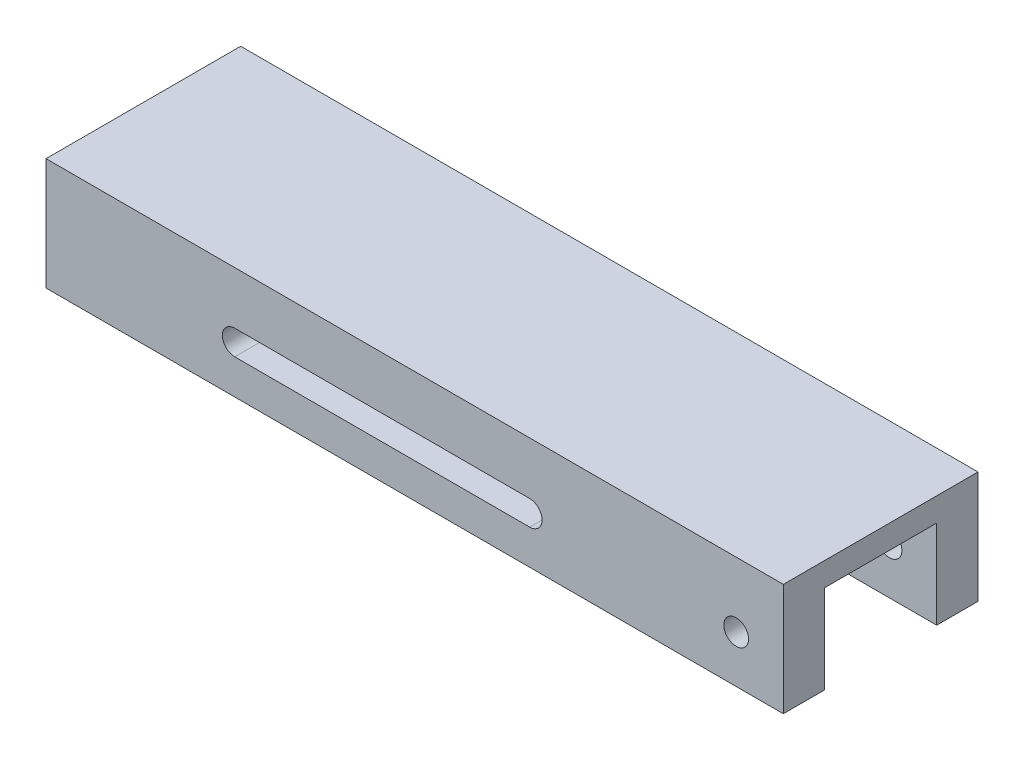
from build123d import *

# Parameters (mm, degrees)
BOSS_EXTRUDE1_DEPTH            = 15
SKETCH3_R                      = 2.1
CUT_EXTRUDE2_DEPTH             = 131.149913561
SKETCH2_W                      = 125
SKETCH2_H                      = 33
BOSS_EXTRUDE4_DEPTH            = 4
SKETCH8_W                      = 7
SKETCH8_H                      = 19
BOSS_EXTRUDE5_DEPTH            = 15
CUT_EXTRUDE4_REACH             = 125.992
SKETCH6_R                      = 3.575
CUT_EXTRUDE4_DIRECTION_2_DEPTH = 124.991935222


with BuildPart() as part:
    # Sketch1 → Boss-Extrude1 (new body)
    with BuildSketch(Plane(origin=(0, 0, 0), x_dir=(1, 0, 0), z_dir=(0, 1, 0))):
        Polygon((125, 26), (125, 33), (0, 33), (0, 0), (125, 0), (125, 7), (7, 7), (7, 26), align=None)
    extrude(amount=BOSS_EXTRUDE1_DEPTH)

    # Sketch3 → Cut-Extrude2 (cut, through all)
    with BuildSketch(Plane.XY):
        with Locations((117, 8)):
            Circle(SKETCH3_R)
        with BuildLine():
            Line((82, 5.9), (32, 5.9))
            ThreePointArc((32, 5.9), (29.9, 8), (32, 10.1))
            Line((32, 10.1), (82, 10.1))
            ThreePointArc((82, 10.1), (84.1, 8), (82, 5.9))
        make_face()
    extrude(amount=-CUT_EXTRUDE2_DEPTH, mode=Mode.SUBTRACT)

    # Sketch2 → Boss-Extrude4 (add)
    with BuildSketch(Plane(origin=(0, 15, 0), x_dir=(1, 0, 0), z_dir=(0, 1, 0))):
        with Locations((62.5, 16.5)):
            Rectangle(SKETCH2_W, SKETCH2_H)
    extrude(amount=BOSS_EXTRUDE4_DEPTH)

    # Sketch8 → Boss-Extrude5 (add)
    with BuildSketch(Plane.XZ.offset(-15)):
        with Locations((93.5, -16.5)):
            Rectangle(SKETCH8_W, SKETCH8_H)
    extrude(amount=BOSS_EXTRUDE5_DEPTH)

    # Cut-Extrude4: up to this face of the body (flat: up to its plane)
    cut_extrude4_end = Plane(part.part.faces().sort_by_distance((97, 7.5, -16.5))[0])
    # Sketch6 → Cut-Extrude4 (cut, up to the picked face)
    with BuildSketch(Plane(origin=(7, 0, 0), x_dir=(0, 0, -1), z_dir=(1, 0, 0)), mode=Mode.PRIVATE) as cut_extrude4_sk1:
        with Locations(Location((16.5, 8, 0), (0, 0, 180))):
            Circle(SKETCH6_R)
    cut_extrude4_tool1 = split(extrude(cut_extrude4_sk1.sketch, amount=CUT_EXTRUDE4_REACH, mode=Mode.PRIVATE), bisect_by=cut_extrude4_end, keep=Keep.BOTH, mode=Mode.PRIVATE)
    add(cut_extrude4_tool1.solids().sort_by(Axis((7, 8, -16.5), (1, 0, 0)))[0], mode=Mode.SUBTRACT)

    # Sketch6 → Cut-Extrude4 direction 2 (cut)
    with BuildSketch(Plane(origin=(7, 0, 0), x_dir=(0, 0, -1), z_dir=(1, 0, 0))):
        with Locations(Location((16.5, 8, 0), (0, 0, 180))):
            Circle(SKETCH6_R)
    extrude(amount=-CUT_EXTRUDE4_DIRECTION_2_DEPTH, mode=Mode.SUBTRACT)


solid = part.part
